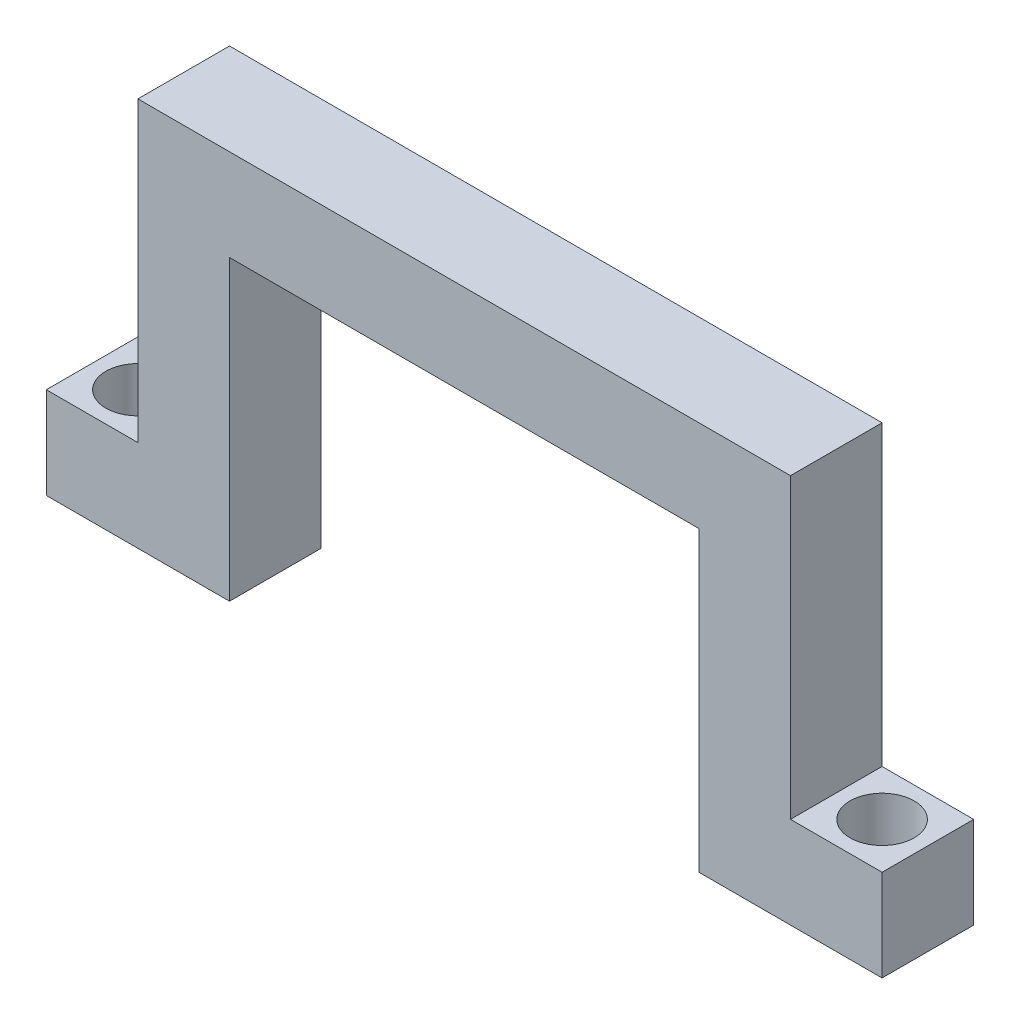
from build123d import *

# Parameters (mm, degrees)
SKETCH1_W           = 36.195
SKETCH1_H           = 5.08
BOSS_EXTRUDE1_DEPTH = 21.59
SKETCH3_W           = 26.035
SKETCH3_H           = 16.51
CUT_EXTRUDE1_DEPTH  = 16.51
SKETCH5_W           = 5.08
SKETCH5_H           = 5.08
BOSS_EXTRUDE2_DEPTH = 5.08
SKETCH6_R           = 1.778
CUT_EXTRUDE2_DEPTH  = 9.144


with BuildPart() as part:
    # Sketch1 → Boss-Extrude1 (new body)
    with BuildSketch(Plane(origin=(0, 0, 0), x_dir=(1, 0, 0), z_dir=(0, 1, 0))):
        with Locations((-4.675909091, -2.54)):
            Rectangle(SKETCH1_W, SKETCH1_H)
    extrude(amount=BOSS_EXTRUDE1_DEPTH)

    # Sketch3 → Cut-Extrude1 (cut)
    with BuildSketch(Plane.XY):
        with Locations((-4.675909091, 8.255)):
            Rectangle(SKETCH3_W, SKETCH3_H)
    extrude(amount=CUT_EXTRUDE1_DEPTH, mode=Mode.SUBTRACT)

    # Sketch5 → Boss-Extrude2 (add)
    with BuildSketch(Plane(origin=(0, 0, 0), x_dir=(1, 0, 0), z_dir=(0, 1, 0))):
        with Locations((-25.313409091, -2.54)):
            Rectangle(SKETCH5_W, SKETCH5_H)
        with Locations((15.961590909, -2.54)):
            Rectangle(SKETCH5_W, SKETCH5_H)
    extrude(amount=BOSS_EXTRUDE2_DEPTH)

    # Sketch6 → Cut-Extrude2 (cut)
    with BuildSketch(Plane(origin=(0, 0, 0), x_dir=(1, 0, 0), z_dir=(0, 1, 0))):
        with Locations(Location((-25.313409091, -2.54, 0), (0, 0, 270))):
            Circle(SKETCH6_R)
        with Locations(Location((15.961590909, -2.54, 0), (0, 0, 90))):
            Circle(SKETCH6_R)
    extrude(amount=CUT_EXTRUDE2_DEPTH, mode=Mode.SUBTRACT)


solid = part.part
